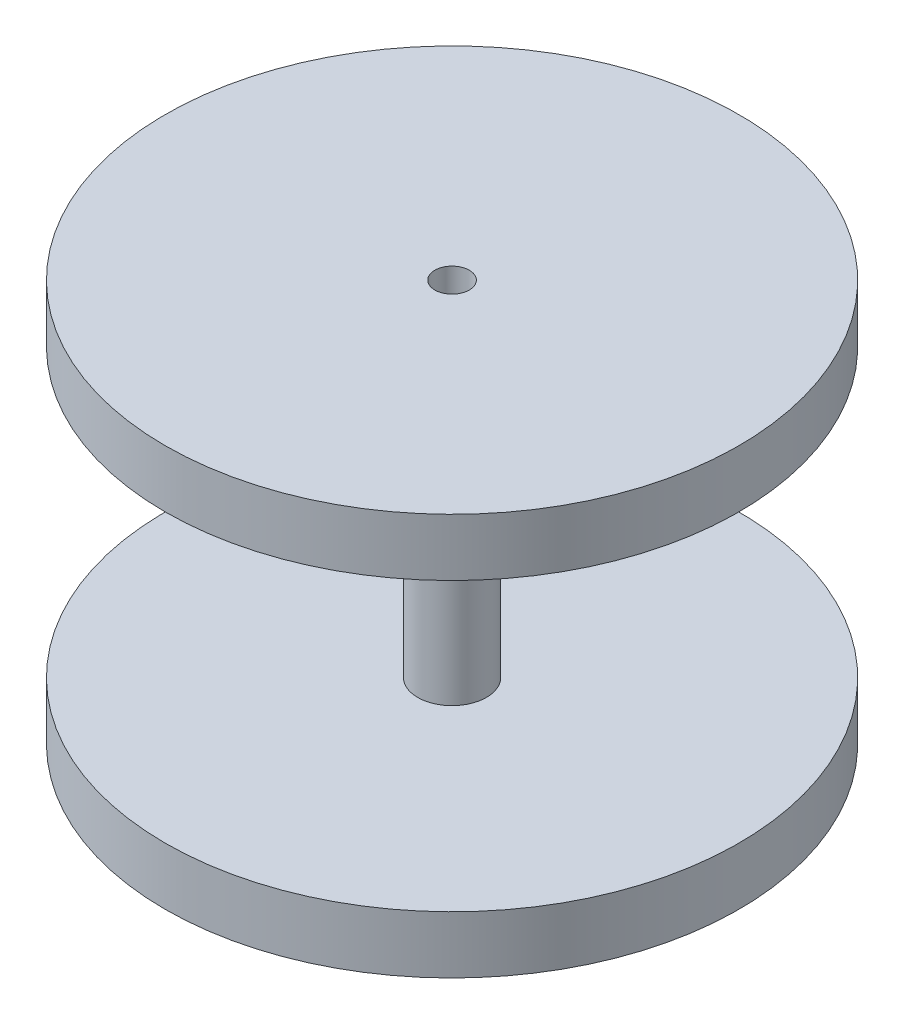
from build123d import *

# Parameters (mm, degrees)
SKETCH1_R           = 25
BOSS_EXTRUDE1_DEPTH = 5
SKETCH2_R           = 3
BOSS_EXTRUDE2_DEPTH = 25
SKETCH3_R           = 25
BOSS_EXTRUDE3_DEPTH = 5
SKETCH4_R           = 1.5
CUT_EXTRUDE1_DEPTH  = 50.749371855


with BuildPart() as part:
    # Sketch1 → Boss-Extrude1 (new body)
    with BuildSketch(Plane(origin=(0, 0, 0), x_dir=(1, 0, 0), z_dir=(0, 1, 0))):
        with Locations(Location((0, 0, 0), (0, 0, 270))):
            Circle(SKETCH1_R)
    extrude(amount=BOSS_EXTRUDE1_DEPTH)

    # Sketch2 → Boss-Extrude2 (add)
    with BuildSketch(Plane(origin=(0, 5, 0), x_dir=(1, 0, 0), z_dir=(0, 1, 0))):
        with Locations(Location((0, 0, 0), (0, 0, 270))):
            Circle(SKETCH2_R)
    extrude(amount=BOSS_EXTRUDE2_DEPTH)

    # Sketch3 → Boss-Extrude3 (add)
    with BuildSketch(Plane(origin=(0, 30, 0), x_dir=(1, 0, 0), z_dir=(0, 1, 0))):
        with Locations(Location((0, 0, 0), (0, 0, 270))):
            Circle(SKETCH3_R)
    extrude(amount=BOSS_EXTRUDE3_DEPTH)

    # Sketch4 → Cut-Extrude1 (cut, through all)
    with BuildSketch(Plane(origin=(0, 35, 0), x_dir=(1, 0, 0), z_dir=(0, 1, 0))):
        with Locations(Location((0, 0, 0), (0, 0, 270))):
            Circle(SKETCH4_R)
    extrude(amount=-CUT_EXTRUDE1_DEPTH, mode=Mode.SUBTRACT)


solid = part.part
